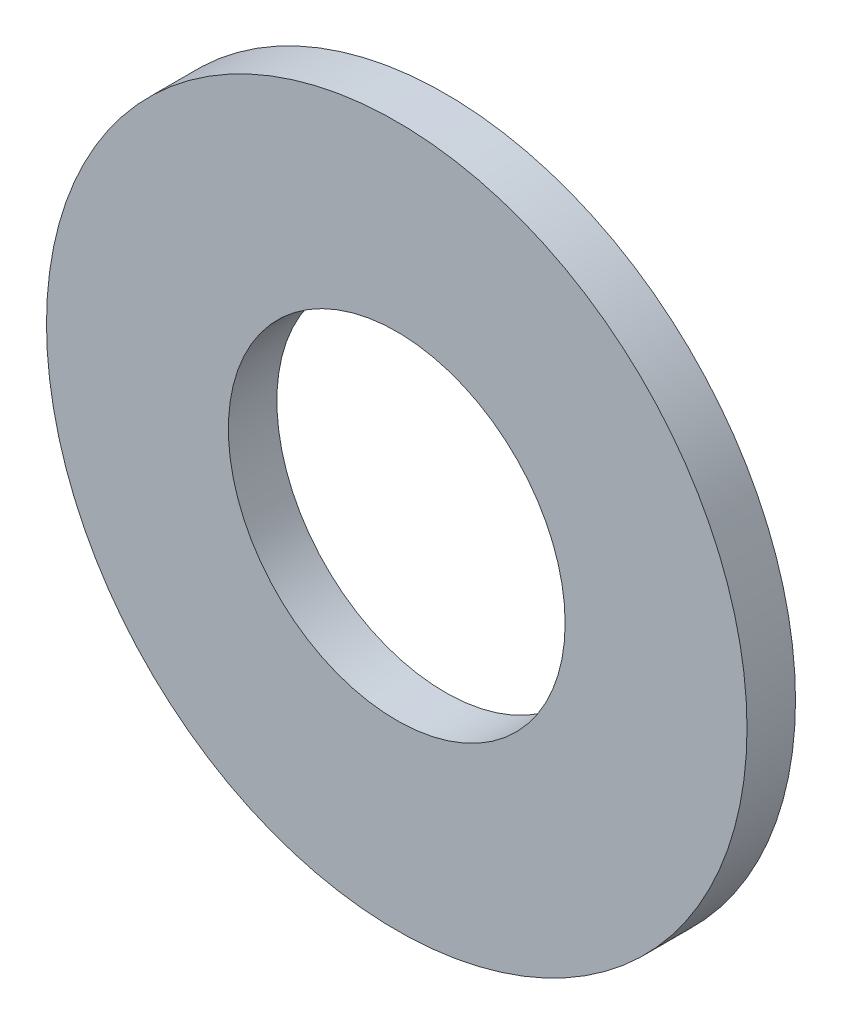
from build123d import *

# Parameters (mm, degrees)
SKETCH1_R           = 26
SKETCH1_R_2         = 12.5
BOSS_EXTRUDE1_DEPTH = 3.6


with BuildPart() as part:
    # Sketch1 → Boss-Extrude1 (new body)
    with BuildSketch(Plane.XY):
        Circle(SKETCH1_R)
        Circle(SKETCH1_R_2, mode=Mode.SUBTRACT)
    extrude(amount=BOSS_EXTRUDE1_DEPTH)


solid = part.part
